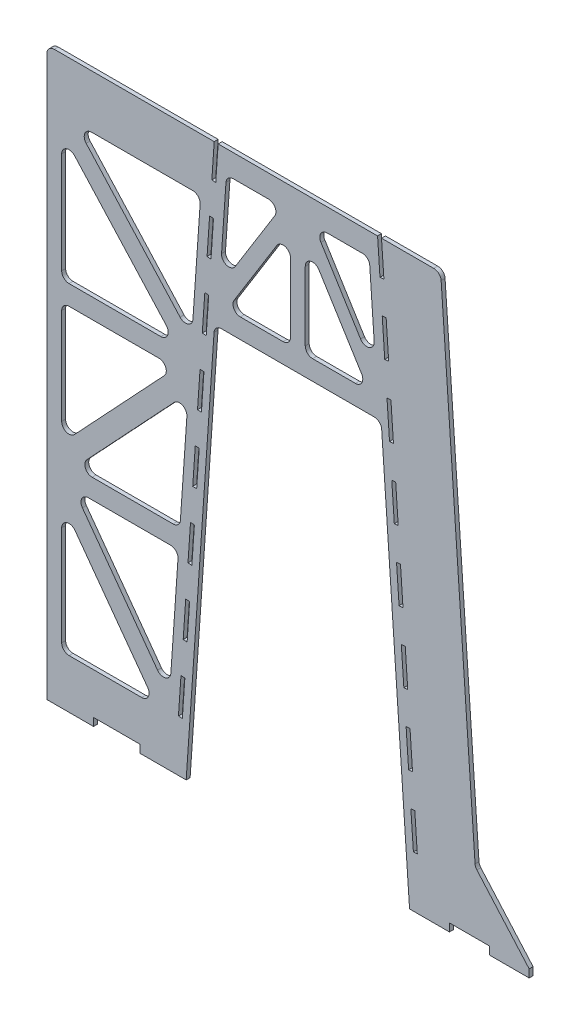
from build123d import *

# Parameters (mm, degrees)
BOSS_EXTRUDE1_DEPTH = 10.16
FILLET1_R           = 19.05
SKETCH2_W           = 120.284747719
SKETCH2_H           = 20.32
SKETCH2_W_2         = 102.891608588
CUT_EXTRUDE1_DEPTH  = 12.7


with BuildPart() as part:
    # Sketch1 → Boss-Extrude1 (new body)
    with BuildSketch(Plane.XY):
        Polygon((-288.275887252, 0), (-215.032557346, 1054.1), (215.032557346, 1054.1), (288.275887252, 0), (596.950713016, 0), (596.950713016, 20.32), (457.769290722, 178.8375841), (368.537470958, 1463.04), (215.892500906, 1463.04), (-205.715298803, 1463.040000035), (-647.718210796, 1463.04), (-647.718210796, 0), align=None)
        Polygon((-609.618210796, 127), (-609.618210796, 461.510956689), (-365.626284392, 127), align=None, mode=Mode.SUBTRACT)
        Polygon((-609.618210796, 592.582701044), (-609.618210796, 907.626666667), (-314.736774564, 907.626666667), align=None, mode=Mode.SUBTRACT)
        Polygon((-282.735998162, 867.476761947), (-304.419486117, 555.413333333), (-574.827649063, 555.413333333), align=None, mode=Mode.SUBTRACT)
        Polygon((-307.949285149, 504.613333333), (-331.453012037, 166.353473425), (-578.179384354, 504.613333333), align=None, mode=Mode.SUBTRACT)
        Polygon((-609.618210796, 958.426666667), (-609.618210796, 1288.067621407), (-310.704175954, 958.426666667), align=None, mode=Mode.SUBTRACT)
        Polygon((-575.330448642, 1325.88), (-250.884200804, 1325.88), (-273.976047339, 993.547820907), align=None, mode=Mode.SUBTRACT)
        Polygon((19.05, 1104.9), (19.05, 1368.504716774), (182.716004616, 1104.9), align=None, mode=Mode.SUBTRACT)
        Polygon((41.473134849, 1404.62), (184.313325179, 1404.62), (202.313466912, 1145.566384812), align=None, mode=Mode.SUBTRACT)
        Polygon((-184.313325179, 1404.62), (-41.473134849, 1404.62), (-202.313466912, 1145.566384812), align=None, mode=Mode.SUBTRACT)
        Polygon((-19.05, 1368.504716774), (-19.05, 1104.9), (-182.716004616, 1104.9), align=None, mode=Mode.SUBTRACT)
    extrude(amount=BOSS_EXTRUDE1_DEPTH)

    # Fillet1
    fillet1_edges = [part.edges().sort_by_distance(p)[0] for p in [
        (19.05, 1368.504716774, 5.08),
        (19.05, 1104.9, 5.08),
        (182.716004616, 1104.9, 5.08),
        (-250.884200804, 1325.88, 5.08),
        (-575.330448642, 1325.88, 5.08),
        (-273.976047339, 993.547820907, 5.08),
        (-647.718210796, 1463.04, 5.08),
        (368.537470958, 1463.04, 5.08),
        (457.769290722, 178.8375841, 5.08),
        (215.032557346, 1054.1, 5.08),
        (-215.032557346, 1054.1, 5.08),
        (-609.618210796, 1288.067621407, 5.08),
        (-609.618210796, 958.426666667, 5.08),
        (-310.704175954, 958.426666667, 5.08),
        (-609.618210796, 461.510956689, 5.08),
        (-609.618210796, 127, 5.08),
        (-365.626284392, 127, 5.08),
        (-41.473134849, 1404.62, 5.08),
        (-184.313325179, 1404.62, 5.08),
        (-202.313466912, 1145.566384812, 5.08),
        (-182.716004616, 1104.9, 5.08),
        (-19.05, 1104.9, 5.08),
        (-19.05, 1368.504716774, 5.08),
        (184.313325179, 1404.62, 5.08),
        (41.473134849, 1404.62, 5.08),
        (202.313466912, 1145.566384812, 5.08),
        (-578.179384354, 504.613333333, 5.08),
        (-331.453012037, 166.353473425, 5.08),
        (-307.949285149, 504.613333333, 5.08),
        (-609.618210796, 907.626666667, 5.08),
        (-609.618210796, 592.582701044, 5.08),
        (-314.736774564, 907.626666667, 5.08),
        (-574.827649063, 555.413333333, 5.08),
        (-304.419486117, 555.413333333, 5.08),
        (-282.735998162, 867.476761947, 5.08),
    ]]
    fillet(fillet1_edges, radius=FILLET1_R)

    # Sketch2 → Cut-Extrude1 (cut)
    with BuildSketch(Plane.XY.offset(10.16)):
        with Locations((-467.291089218, 10.16)):
            Rectangle(SKETCH2_W, SKETCH2_H)
        with Locations((442.613300134, 10.16)):
            Rectangle(SKETCH2_W_2, SKETCH2_H)
        Polygon((211.92306481, 1373.664189215), (222.040744894, 1374.366931824), (215.881789204, 1463.040000035), (205.715298803, 1463.040000035), align=None)
        Polygon((234.358656272, 1197.020795404), (227.836927701, 1290.916856945), (217.719247617, 1290.214114336), (224.240976188, 1196.318052795), align=None)
        Polygon((246.676567651, 1019.674658983), (240.15668194, 1113.544188093), (230.039001856, 1112.841445484), (236.558887567, 1018.971916374), align=None)
        Polygon((258.99447903, 842.328522563), (252.476436179, 936.171519242), (242.358756095, 935.468776633), (248.876798945, 841.625779953), align=None)
        Polygon((271.312390408, 664.982386142), (264.796190418, 758.798850391), (254.678510334, 758.096107781), (261.194710324, 664.279643533), align=None)
        Polygon((283.630301787, 487.636249721), (277.115944656, 581.426181539), (266.998264572, 580.72343893), (273.512621703, 486.933507112), align=None)
        Polygon((295.948213166, 310.290113301), (289.435698895, 404.053512688), (279.318018811, 403.350770078), (285.830533081, 309.587370692), align=None)
        Polygon((308.266124544, 132.94397688), (301.755453134, 226.680843836), (291.63777305, 225.978101227), (298.14844446, 132.241234271), align=None)
        Polygon((-301.755453134, 226.680843836), (-308.266124544, 132.94397688), (-298.14844446, 132.241234271), (-291.63777305, 225.978101227), align=None)
        Polygon((-289.435698895, 404.053512688), (-295.948213166, 310.290113301), (-285.830533081, 309.587370692), (-279.318018811, 403.350770078), align=None)
        Polygon((-277.115944656, 581.426181539), (-283.630301787, 487.636249721), (-273.512621703, 486.933507112), (-266.998264572, 580.72343893), align=None)
        Polygon((-264.796190418, 758.798850391), (-271.312390408, 664.982386142), (-261.194710324, 664.279643533), (-254.678510334, 758.096107781), align=None)
        Polygon((-252.476436179, 936.171519242), (-258.99447903, 842.328522563), (-248.876798945, 841.625779953), (-242.358756095, 935.468776633), align=None)
        Polygon((-240.15668194, 1113.544188093), (-246.676567651, 1019.674658983), (-236.558887567, 1018.971916374), (-230.039001856, 1112.841445484), align=None)
        Polygon((-227.836927701, 1290.916856945), (-234.358656272, 1197.020795404), (-224.240976188, 1196.318052795), (-217.719247617, 1290.214114336), align=None)
        Polygon((-222.040744894, 1374.366931824), (-211.92306481, 1373.664189215), (-205.715298803, 1463.040000035), (-215.881789204, 1463.040000035), align=None)
    extrude(amount=-CUT_EXTRUDE1_DEPTH, mode=Mode.SUBTRACT)


solid = part.part
